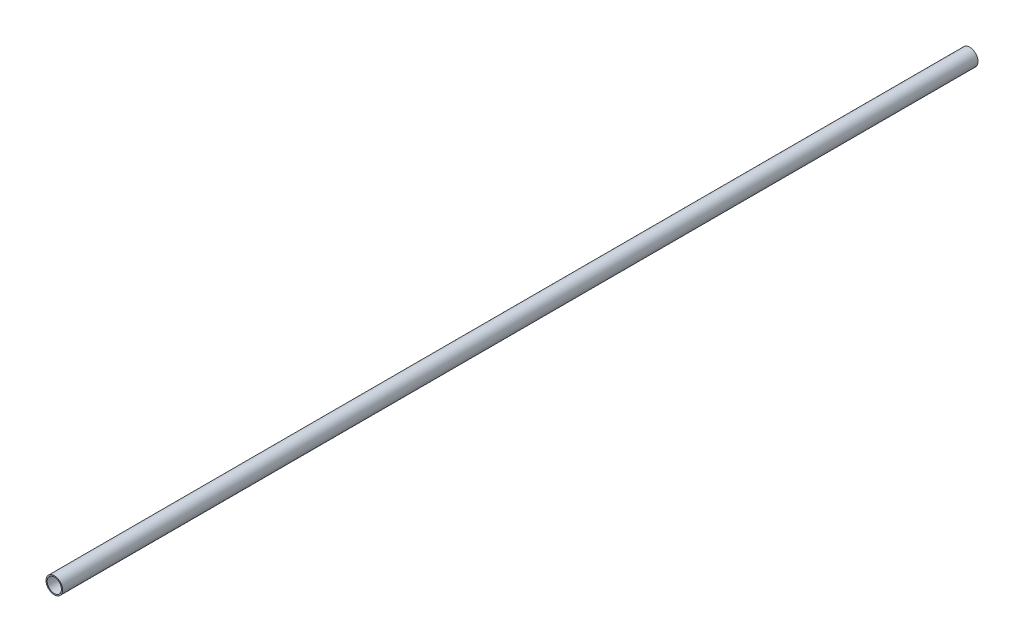
from build123d import *

# Parameters (mm, degrees)
SKETCH2_R           = 5.5245
SKETCH2_R_2         = 4.7625
BOSS_EXTRUDE1_DEPTH = 609.6


with BuildPart() as part:
    # Sketch2 → Boss-Extrude1 (new body)
    with BuildSketch(Plane.XY):
        with Locations(Location((0, 0, 0), (0, 0, 180))):
            Circle(SKETCH2_R)
        with Locations(Location((0, 0, 0), (0, 0, 180))):
            Circle(SKETCH2_R_2, mode=Mode.SUBTRACT)
    extrude(amount=BOSS_EXTRUDE1_DEPTH)


solid = part.part
